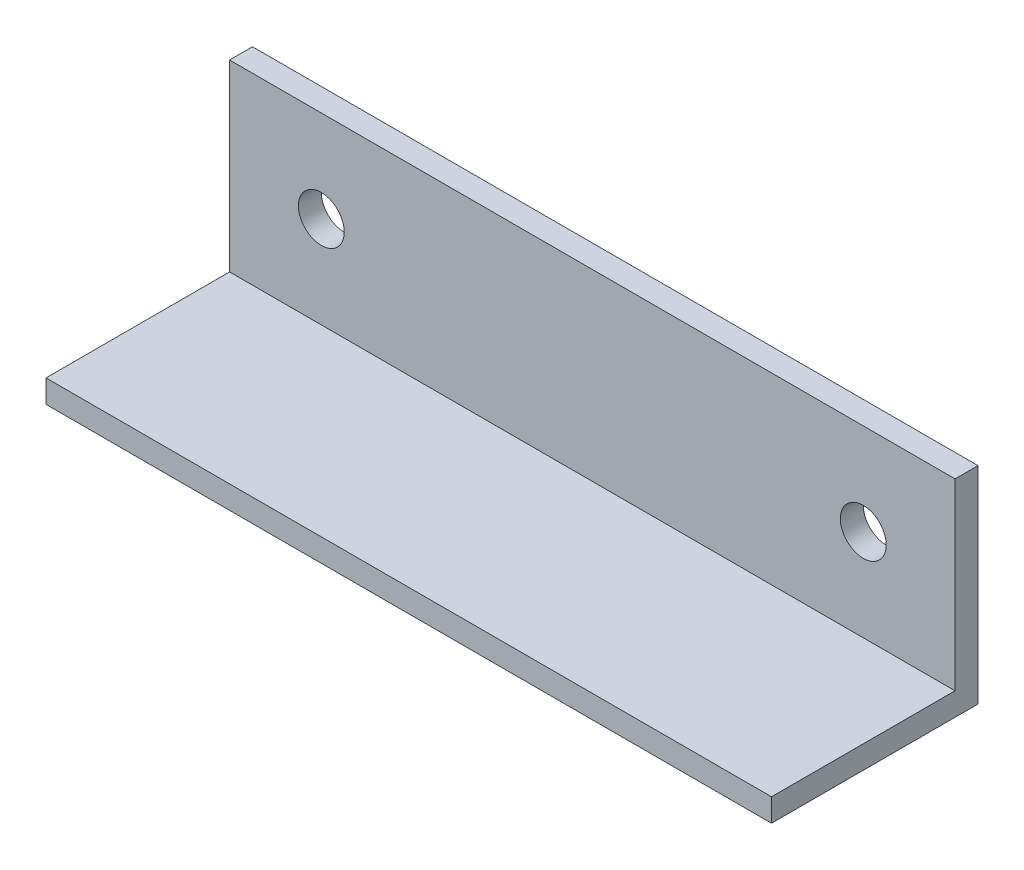
from build123d import *

# Parameters (mm, degrees)
SKETCH1_W           = 100.4
SKETCH1_H           = 28.575
SKETCH1_R           = 3.175
BOSS_EXTRUDE1_DEPTH = 3.175
SKETCH2_W           = 100.4
SKETCH2_H           = 3.175
BOSS_EXTRUDE2_DEPTH = 25.4


with BuildPart() as part:
    # Sketch1 → Boss-Extrude1 (new body)
    with BuildSketch(Plane.XY):
        with Locations((37.5, -1.5875)):
            Rectangle(SKETCH1_W, SKETCH1_H)
        Circle(SKETCH1_R, mode=Mode.SUBTRACT)
        with Locations((75, 0)):
            Circle(SKETCH1_R, mode=Mode.SUBTRACT)
    extrude(amount=BOSS_EXTRUDE1_DEPTH)

    # Sketch2 → Boss-Extrude2 (add)
    with BuildSketch(Plane.XY.offset(3.175)):
        with Locations((37.5, -14.2875)):
            Rectangle(SKETCH2_W, SKETCH2_H)
    extrude(amount=BOSS_EXTRUDE2_DEPTH)


solid = part.part
